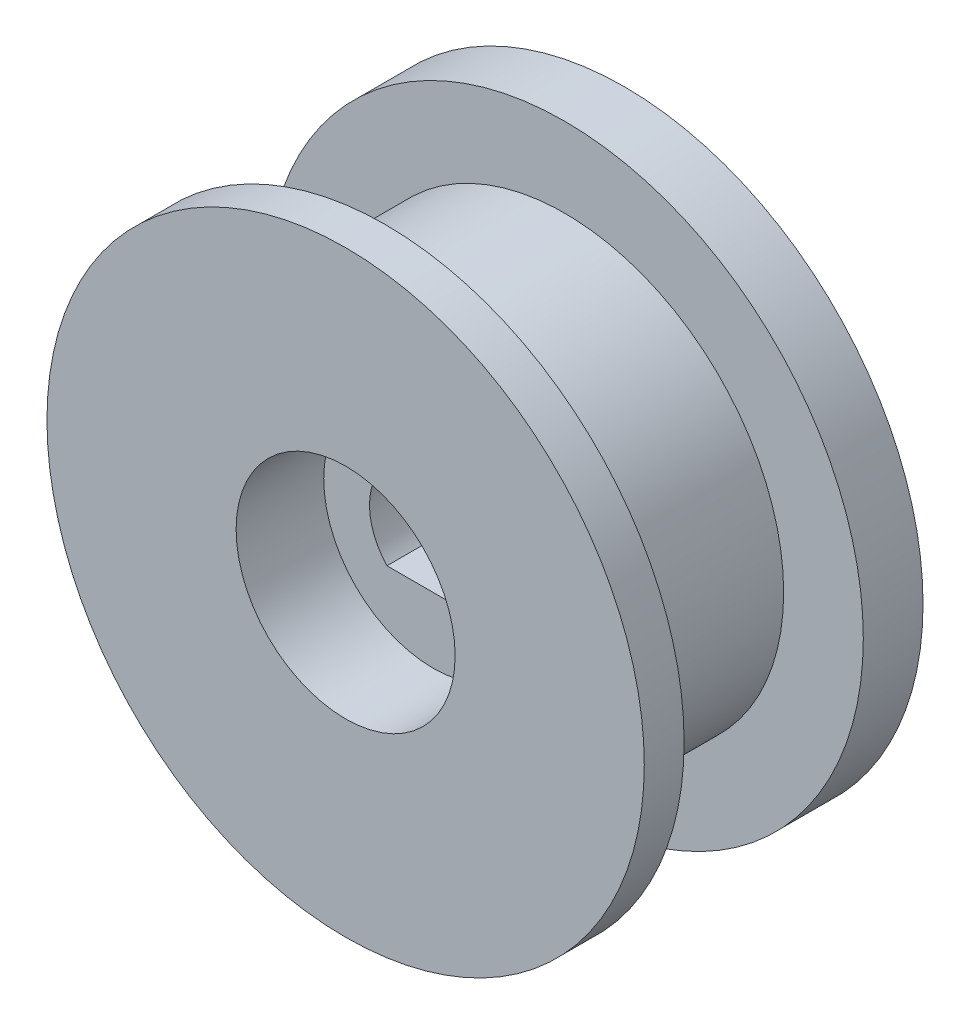
from build123d import *

# Parameters (mm, degrees)
SKETCH2_R           = 3
CUT_EXTRUDE1_DEPTH  = 2
SKETCH3_R           = 2.25
SKETCH3_R_2         = 1.25
BOSS_EXTRUDE1_DEPTH = 5
SKETCH4_R           = 1.6
CUT_EXTRUDE2_DEPTH  = 10
BOSS_EXTRUDE2_DEPTH = 7
SKETCH6_R           = 2.75
CUT_EXTRUDE4_DEPTH  = 2.2
CUT_EXTRUDE5_START  = -2.2
SKETCH7_R           = 2.75
CUT_EXTRUDE5_DEPTH  = 2.2


with BuildPart() as part:
    # Sketch1 → Revolve1 (revolve)
    with BuildSketch(Plane(origin=(0, 0, 0), x_dir=(1, 0, 0), z_dir=(0, 1, 0))):
        Polygon((1.25, 0), (7.5, 0), (7.5, 1), (5.5, 1), (5.5, 5.5), (7.5, 5.5), (7.5, 7), (3, 7), (3, 9), (2.25, 9), (2.25, 2), (1.25, 2), align=None)
    revolve(axis=Axis((0, 0, 0), (0, 0, -1)))

    # Sketch2 → Cut-Extrude1 (cut)
    with BuildSketch(Plane(origin=(0, 0, -9), x_dir=(-1, 0, 0), z_dir=(0, 0, -1))):
        Circle(SKETCH2_R)
    extrude(amount=-CUT_EXTRUDE1_DEPTH, mode=Mode.SUBTRACT)

    # Sketch3 → Boss-Extrude1 (add)
    with BuildSketch(Plane(origin=(0, 0, -2), x_dir=(-1, 0, 0), z_dir=(0, 0, -1))):
        Circle(SKETCH3_R)
        Circle(SKETCH3_R_2, mode=Mode.SUBTRACT)
    extrude(amount=BOSS_EXTRUDE1_DEPTH)

    # Sketch4 → Cut-Extrude2 (cut)
    with BuildSketch(Plane(origin=(0, 0, -7), x_dir=(-1, 0, 0), z_dir=(0, 0, -1))):
        Circle(SKETCH4_R)
    extrude(amount=-CUT_EXTRUDE2_DEPTH, mode=Mode.SUBTRACT)

    # Sketch5 → Boss-Extrude2 (add)
    with BuildSketch(Plane(origin=(0, 0, -7), x_dir=(-1, 0, 0), z_dir=(0, 0, -1))):
        with BuildLine():
            Line((-1.161895004, -1.1), (1.161895004, -1.1))
            ThreePointArc((1.161895004, -1.1), (0, -1.6), (-1.161895004, -1.1))
        make_face()
    extrude(amount=-BOSS_EXTRUDE2_DEPTH)

    # Sketch6 → Cut-Extrude4 (cut)
    with BuildSketch(Plane.XY):
        Circle(SKETCH6_R)
    extrude(amount=-CUT_EXTRUDE4_DEPTH, mode=Mode.SUBTRACT)

    # Sketch7 → Cut-Extrude5 (cut)
    with BuildSketch(Plane(origin=(0, 0, -7), x_dir=(-1, 0, 0), z_dir=(0, 0, -1)).offset(CUT_EXTRUDE5_START)):
        Circle(SKETCH7_R)
    extrude(amount=CUT_EXTRUDE5_DEPTH, mode=Mode.SUBTRACT)


solid = part.part
